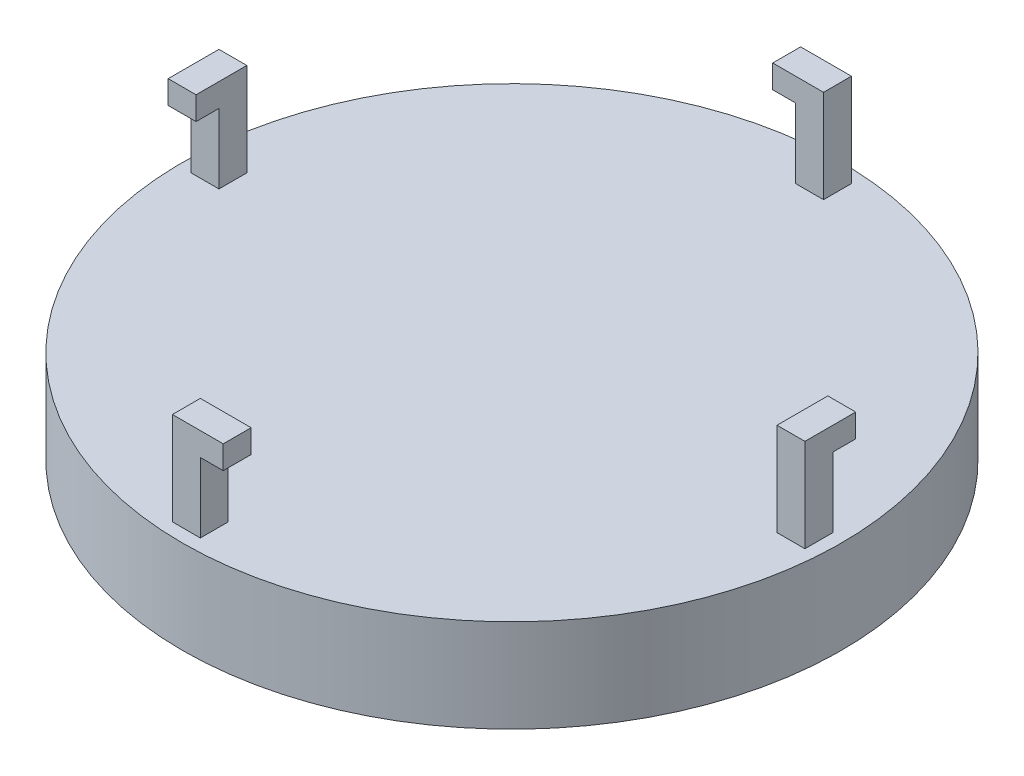
from build123d import *

# Parameters (mm, degrees)
SKETCH1_R           = 45
BOSS_EXTRUDE1_DEPTH = 12.7
SKETCH2_W           = 3.81
SKETCH2_H           = 3.81
BOSS_EXTRUDE2_DEPTH = 12.7
SKETCH3_W           = 3.81
SKETCH3_H           = 3.175
BOSS_EXTRUDE3_DEPTH = 3.125
CIRPATTERN2_COUNT   = 4


with BuildPart() as part:
    # Sketch1 → Boss-Extrude1 (new body)
    with BuildSketch(Plane(origin=(0, 0, 0), x_dir=(1, 0, 0), z_dir=(0, 1, 0))):
        with Locations(Location((0, 0, 0), (0, 0, 270))):
            Circle(SKETCH1_R)
    extrude(amount=BOSS_EXTRUDE1_DEPTH)

    # Sketch2 → Boss-Extrude2 (add)
    with BuildSketch(Plane(origin=(0, 12.7, 0), x_dir=(1, 0, 0), z_dir=(0, 1, 0))):
        with Locations((-41.275, 1.27)):
            Rectangle(SKETCH2_W, SKETCH2_H)
    boss_extrude2 = extrude(amount=BOSS_EXTRUDE2_DEPTH)

    # Sketch3 → Boss-Extrude3 (add)
    with BuildSketch(Plane.XY.offset(0.635)):
        with Locations((-41.275, 23.8125)):
            Rectangle(SKETCH3_W, SKETCH3_H)
    boss_extrude3 = extrude(amount=BOSS_EXTRUDE3_DEPTH)

    # CirPattern2: Boss-Extrude2, Boss-Extrude3 ×4 about axis
    cirpattern2_axis = Axis((0, 0, 0), (0, 1, 0))
    add([boss_extrude2.rotate(cirpattern2_axis, i * 360 / CIRPATTERN2_COUNT) for i in range(1, CIRPATTERN2_COUNT)])
    add([boss_extrude3.rotate(cirpattern2_axis, i * 360 / CIRPATTERN2_COUNT) for i in range(1, CIRPATTERN2_COUNT)])


solid = part.part
